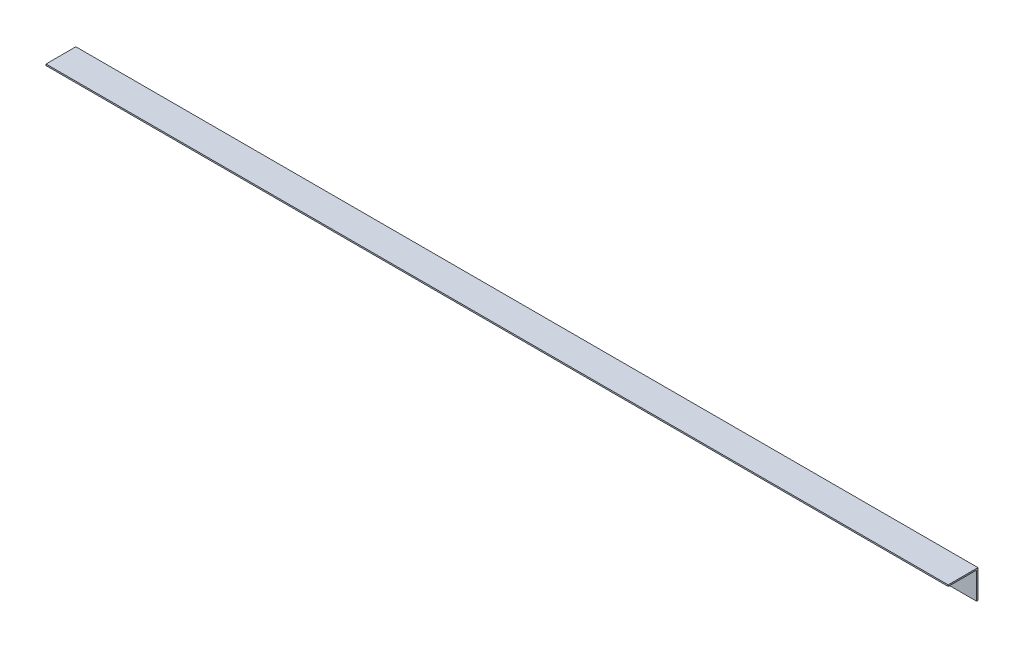
from build123d import *

# Parameters (mm, degrees)
ESQUISSE1_W        = 635
ESQUISSE1_H        = 20
BOSS_EXTRU_1_DEPTH = 1
ESQUISSE2_W        = 635
ESQUISSE2_H        = 1
BOSS_EXTRU_2_DEPTH = 20


with BuildPart() as part:
    # Esquisse1 → Boss.-Extru.1 (new body)
    with BuildSketch(Plane.XY):
        with Locations((317.5, 10)):
            Rectangle(ESQUISSE1_W, ESQUISSE1_H)
    extrude(amount=BOSS_EXTRU_1_DEPTH)

    # Esquisse2 → Boss.-Extru.2 (add)
    with BuildSketch(Plane.XY.offset(1)):
        with Locations((317.5, 19.5)):
            Rectangle(ESQUISSE2_W, ESQUISSE2_H)
    extrude(amount=BOSS_EXTRU_2_DEPTH)


solid = part.part
